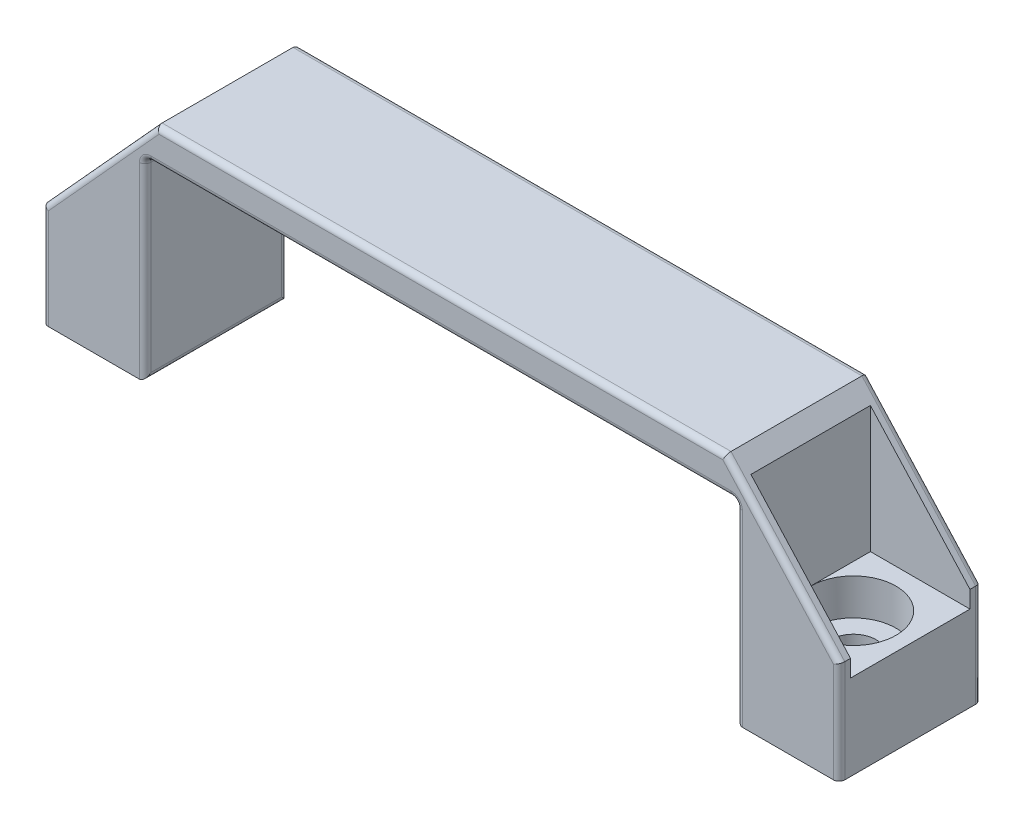
from build123d import *

# Parameters (mm, degrees)
SKETCH_1_W                   = 140
SKETCH_1_H                   = 25
EXTRUDE_1_DEPTH              = 40
SKETCH_2_W                   = 104
SKETCH_2_H                   = 34
CUT_EXTRUDE_1_DEPTH          = 85.409715081
SKETCH_3_W                   = 17.5
SKETCH_3_H                   = 21
CUT_EXTRUDE_2_DEPTH          = 25
HOLE_WIZARD_M6_1_D           = 8
HOLE_WIZARD_M6_1_CBORE_D     = 15
HOLE_WIZARD_M6_1_CBORE_DEPTH = 6.4
FILLET_1_R                   = 1
FILLET_2_R                   = 1


with BuildPart() as part:
    # 草图1 → 凸台-拉伸1 (new body)
    with BuildSketch(Plane(origin=(0, 0, 0), x_dir=(1, 0, 0), z_dir=(0, 1, 0))):
        Rectangle(SKETCH_1_W, SKETCH_1_H)
    extrude(amount=EXTRUDE_1_DEPTH)

    # 草图2 → 切除-拉伸1 (cut, through all)
    with BuildSketch(Plane.XY.offset(12.5)):
        with Locations((0, 17)):
            Rectangle(SKETCH_2_W, SKETCH_2_H)
        Polygon((-70, 40), (-50, 40), (-70, 18), align=None)
        Polygon((70, 40), (50, 40), (70, 18), align=None)
    extrude(amount=-CUT_EXTRUDE_1_DEPTH, mode=Mode.SUBTRACT)

    # 草图3 → 切除-拉伸2 (cut)
    with BuildSketch(Plane(origin=(0, 40, 0), x_dir=(1, 0, 0), z_dir=(0, 1, 0))):
        with Locations((-61.25, 0)):
            Rectangle(SKETCH_3_W, SKETCH_3_H)
        with Locations((61.25, 0)):
            Rectangle(SKETCH_3_W, SKETCH_3_H)
    extrude(amount=-CUT_EXTRUDE_2_DEPTH, mode=Mode.SUBTRACT)

    # M6 六角凹头螺钉的柱形沉头孔1 (through all)
    with Locations(Plane(origin=(0, 15, 0), x_dir=(-1, 0, 0), z_dir=(0, 1, 0))):
        with Locations((60, 0), (-60, 0)):
            CounterBoreHole(HOLE_WIZARD_M6_1_D / 2, HOLE_WIZARD_M6_1_CBORE_D / 2, HOLE_WIZARD_M6_1_CBORE_DEPTH)

    # 圆角1
    fillet_1_edges = [part.edges().sort_by_distance(p)[0] for p in [
        (-52, 17, -12.5),
        (-52, 0, 0),
        (0, 34, -12.5),
        (-52, 34, 0),
        (52, 17, -12.5),
        (52, 34, 0),
        (52, 0, 0),
        (-52, 17, 12.5),
        (52, 17, 12.5),
        (0, 34, 12.5),
    ]]
    fillet(fillet_1_edges, radius=FILLET_1_R)

    # 圆角2
    fillet_2_edges = [part.edges().sort_by_distance(p)[0] for p in [
        (0, 40, 12.5),
        (-70, 9, -12.5),
        (-70, 9, 12.5),
        (-60, 29, -12.5),
        (-60, 29, 12.5),
        (0, 40, -12.5),
        (70, 9, -12.5),
        (70, 9, 12.5),
        (60, 29, -12.5),
        (60, 29, 12.5),
    ]]
    fillet(fillet_2_edges, radius=FILLET_2_R)


solid = part.part
